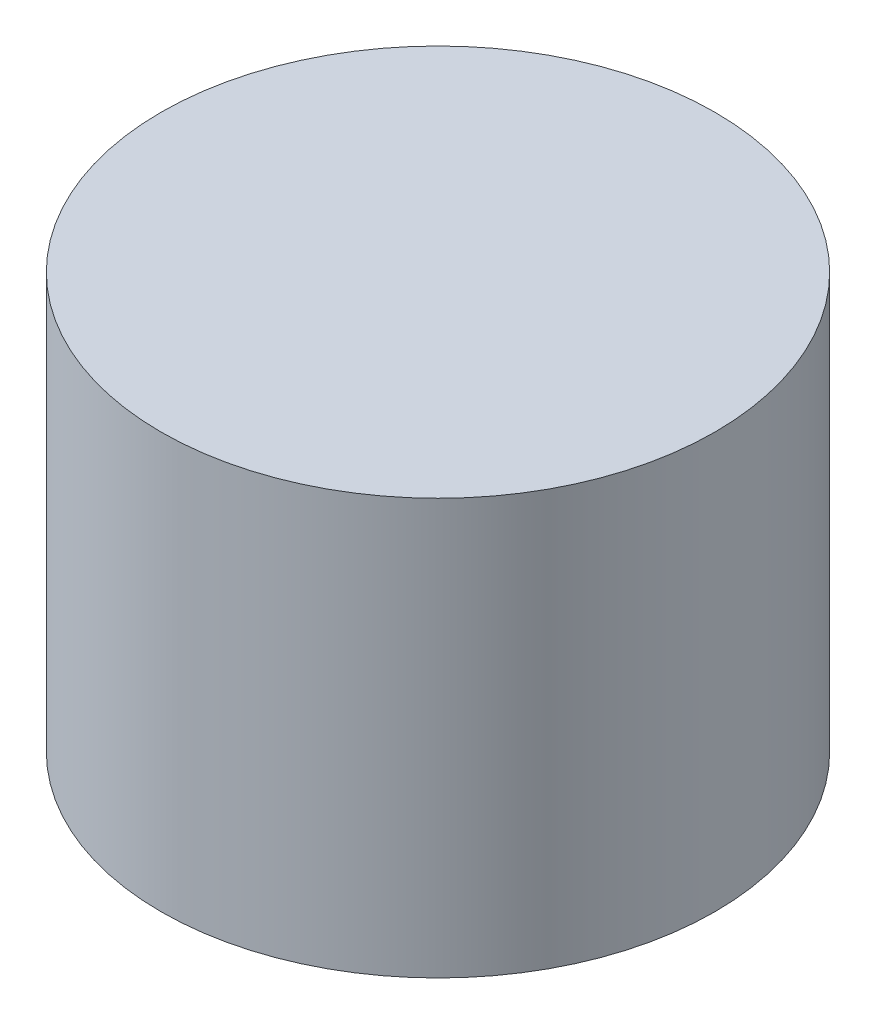
from build123d import *

# Parameters (mm, degrees)
SKETCH1_R           = 8
BOSS_EXTRUDE1_DEPTH = 12


with BuildPart() as part:
    # Sketch1 → Boss-Extrude1 (new body)
    with BuildSketch(Plane(origin=(0, 0, 0), x_dir=(1, 0, 0), z_dir=(0, 1, 0))):
        with Locations(Location((-36.445256674, 29.866963457, 0), (0, 0, 270))):
            Circle(SKETCH1_R)
    extrude(amount=BOSS_EXTRUDE1_DEPTH)


solid = part.part
